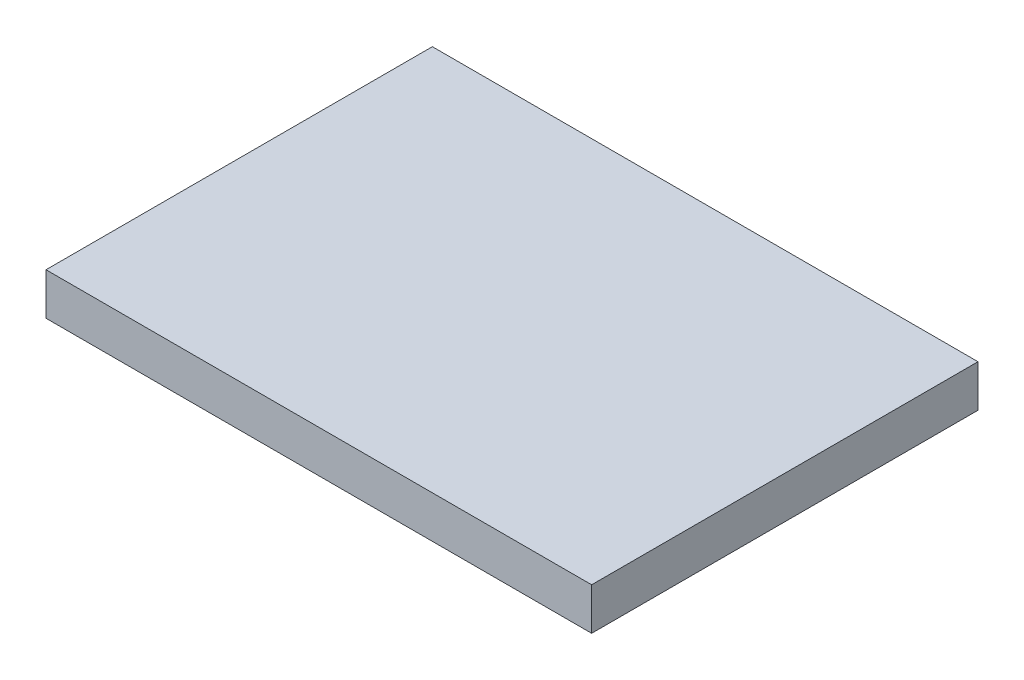
from build123d import *

# Parameters (mm, degrees)
SKETCH1_W           = 116.8
SKETCH1_H           = 82.7
BOSS_EXTRUDE1_DEPTH = 9


with BuildPart() as part:
    # Sketch1 → Boss-Extrude1 (new body)
    with BuildSketch(Plane(origin=(0, 0, 0), x_dir=(1, 0, 0), z_dir=(0, 1, 0))):
        with Locations((58.4, 41.35)):
            Rectangle(SKETCH1_W, SKETCH1_H)
    extrude(amount=BOSS_EXTRUDE1_DEPTH)


solid = part.part
